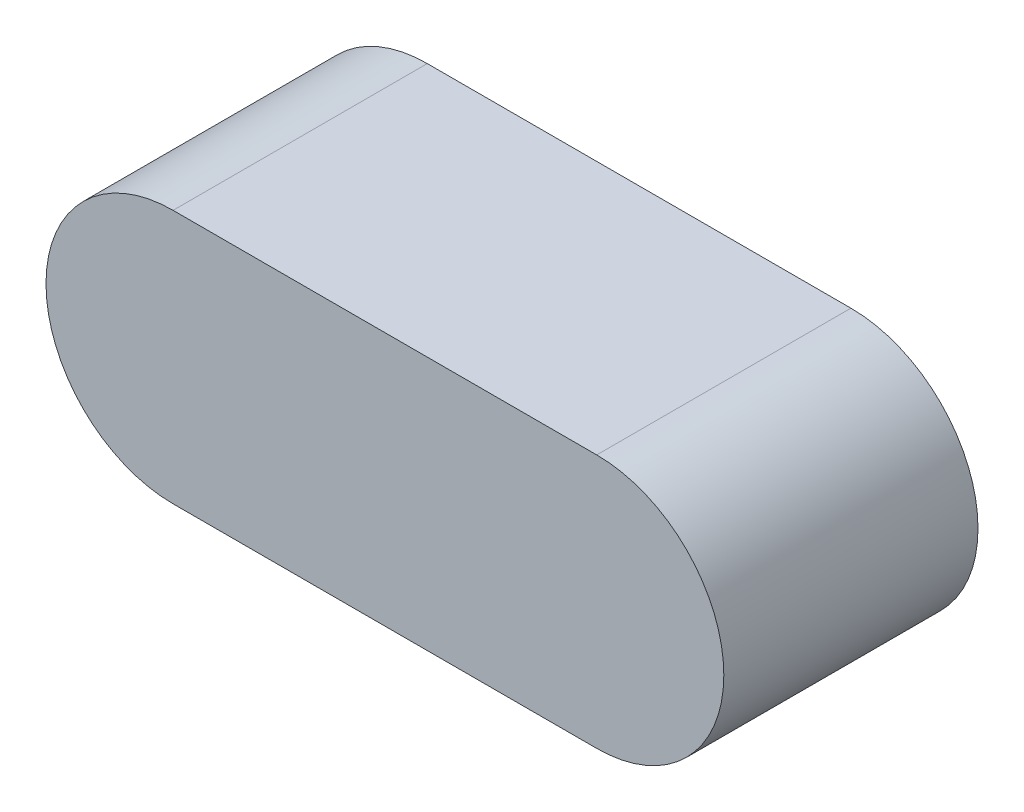
from build123d import *

# Parameters (mm, degrees)
DODANIE_WYCI_GNI_CIE1_DEPTH = 1.5


with BuildPart() as part:
    # Szkic1 → Dodanie-wyciągnięcie1 (new, symmetric)
    with BuildSketch(Plane.XY):
        with BuildLine():
            Line((0, 1.5), (5, 1.5))
            ThreePointArc((5, 1.5), (6.5, 0), (5, -1.5))
            Line((5, -1.5), (0, -1.5))
            ThreePointArc((0, -1.5), (-1.5, 0), (0, 1.5))
        make_face()
    extrude(amount=DODANIE_WYCI_GNI_CIE1_DEPTH, both=True)


solid = part.part
